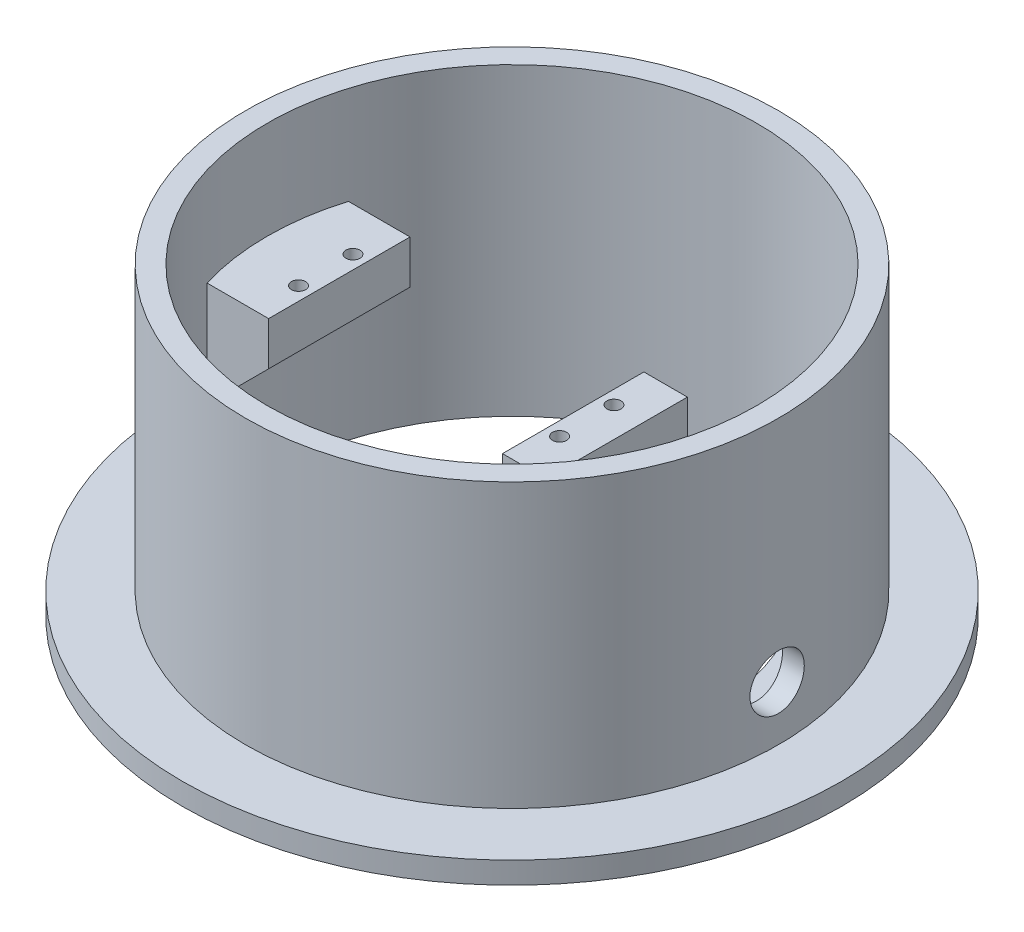
from build123d import *

# Parameters (mm, degrees)
SKETCH1_R               = 60.625
SKETCH1_R_2             = 45
BOSS_EXTRUDE1_DEPTH     = 4
SKETCH2_R               = 49
SKETCH2_R_2             = 45
BOSS_EXTRUDE2_DEPTH     = 52
SKETCH4_W               = 13.25
SKETCH4_H               = 8
SKETCH4_W_2             = 8
SKETCH4_H_2             = 38
BOSS_EXTRUDE4_DEPTH     = 13
BOSS_EXTRUDE5_DEPTH     = 4
SKETCH7_R               = 1.3
CUT_EXTRUDE4_DEPTH      = 7.2
SKETCH9_W               = 10
SKETCH9_H               = 24
CUT_EXTRUDE7_DEPTH      = 8
CUT_EXTRUDE8_REACH      = 139.219
CUT_EXTRUDE8_END_RADIUS = 45
SKETCH11_R              = 5
CUT_EXTRUDE9_DEPTH      = 101.273532203


with BuildPart() as part:
    # Sketch1 → Boss-Extrude1 (new body)
    with BuildSketch(Plane(origin=(0, 0, 0), x_dir=(1, 0, 0), z_dir=(0, 1, 0))):
        with Locations(Location((0, 0, 0), (0, 0, 270))):
            Circle(SKETCH1_R)
        with Locations(Location((0, 0, 0), (0, 0, 270))):
            Circle(SKETCH1_R_2, mode=Mode.SUBTRACT)
    extrude(amount=BOSS_EXTRUDE1_DEPTH)

    # Sketch2 → Boss-Extrude2 (add)
    with BuildSketch(Plane(origin=(0, 4, 0), x_dir=(1, 0, 0), z_dir=(0, 1, 0))):
        with Locations(Location((0, 0, 0), (0, 0, 90))):
            Circle(SKETCH2_R)
        with Locations(Location((0, 0, 0), (0, 0, 270))):
            Circle(SKETCH2_R_2, mode=Mode.SUBTRACT)
    extrude(amount=BOSS_EXTRUDE2_DEPTH)

    # Sketch4 → Boss-Extrude4 (add, symmetric)
    with BuildSketch(Plane.XY):
        with Locations((-38.375, 34)):
            Rectangle(SKETCH4_W, SKETCH4_H)
        Polygon((-31.75, 30), (-45, 30), (-45, 16.75), align=None)
        with Locations((15.25, 19)):
            Rectangle(SKETCH4_W_2, SKETCH4_H_2)
    extrude(amount=BOSS_EXTRUDE4_DEPTH, both=True)


with BuildPart() as boss_extrude4_piece_1:
    # of the separate pieces the step leaves, piece 1, a body of its own (boss_extrude4_pieces)
    add(part.part.solids().sort_by_distance((0, 0, 60.625))[0])



with BuildPart() as boss_extrude4_piece_2:
    # of the separate pieces the step leaves, piece 2, a body of its own (boss_extrude4_pieces)
    add(part.part.solids().sort_by_distance((11.25, 38, -13))[0])


with BuildPart() as boss_extrude4_piece_1_1:
    add(boss_extrude4_piece_1.part)

    add(boss_extrude4_piece_2.part)  # Boss-Extrude5 merges Boss-Extrude4 piece 2
    # Sketch5 → Boss-Extrude5 (add)
    with BuildSketch(Plane.XZ):
        with BuildLine():
            Line((11.25, 13), (29.067400866, 34.352382842))
            ThreePointArc((29.067400866, 34.352382842), (45, 0), (29.067400866, -34.352382842))
            Line((29.067400866, -34.352382842), (11.25, -13))
            Line((11.25, -13), (11.25, 13))
        make_face()
    extrude(amount=-BOSS_EXTRUDE5_DEPTH)

    # Sketch7 → Cut-Extrude4 (cut)
    with BuildSketch(Plane(origin=(0, 38, 0), x_dir=(1, 0, 0), z_dir=(0, 1, 0))):
        with Locations(Location((-34.25, 5, 0), (0, 0, 180))):
            Circle(SKETCH7_R)
        with Locations(Location((-34.25, -5, 0), (0, 0, 180))):
            Circle(SKETCH7_R)
        with Locations(Location((13.75, 5, 0), (0, 0, 180))):
            Circle(SKETCH7_R)
        with Locations(Location((13.75, -5, 0), (0, 0, 180))):
            Circle(SKETCH7_R)
    extrude(amount=-CUT_EXTRUDE4_DEPTH, mode=Mode.SUBTRACT)

    # Sketch9 → Cut-Extrude7 (cut)
    with BuildSketch(Plane.ZY.offset(-11.25)):
        with Locations((0, 17)):
            Rectangle(SKETCH9_W, SKETCH9_H)
    extrude(amount=-CUT_EXTRUDE7_DEPTH, mode=Mode.SUBTRACT)

    # Cut-Extrude8: up to this cylinder (the profile starts outside it)
    cut_extrude8_end = Plane(origin=(0, 14, 0), z_dir=(0, -1, 0)) * Cylinder(CUT_EXTRUDE8_END_RADIUS, 369.438, mode=Mode.PRIVATE)
    # Sketch11 → Cut-Extrude8 (cut, up to the surface)
    with BuildSketch(Plane(origin=(49, 0, 0), x_dir=(0, 0, -1), z_dir=(1, 0, 0)), mode=Mode.PRIVATE) as cut_extrude8_sk1:
        with Locations((0, 14)):
            Circle(SKETCH11_R)
    cut_extrude8_tool1 = extrude(cut_extrude8_sk1.sketch, amount=-CUT_EXTRUDE8_REACH, mode=Mode.PRIVATE) - cut_extrude8_end
    add(cut_extrude8_tool1.solids().sort_by_distance((49, 14, 0))[0], mode=Mode.SUBTRACT)

    # Sketch12 → Cut-Extrude9 (cut, through all)
    with BuildSketch(Plane(origin=(0, 4, 0), x_dir=(1, 0, 0), z_dir=(0, 1, 0))):
        with BuildLine():
            Line((29.479537487, 22.359715328), (27.25, 19.687836398))
            Line((27.25, 19.687836398), (27.25, -19.687836398))
            Line((27.25, -19.687836398), (29.479537487, -22.359715328))
            ThreePointArc((29.479537487, -22.359715328), (37, 0), (29.479537487, 22.359715328))
        make_face()
        Polygon((27.25, -19.687836398), (27.25, 19.687836398), (24.25, 16.092634774), (24.25, -16.092634774), align=None)
    extrude(amount=-CUT_EXTRUDE9_DEPTH, mode=Mode.SUBTRACT)


solid = boss_extrude4_piece_1_1.part
